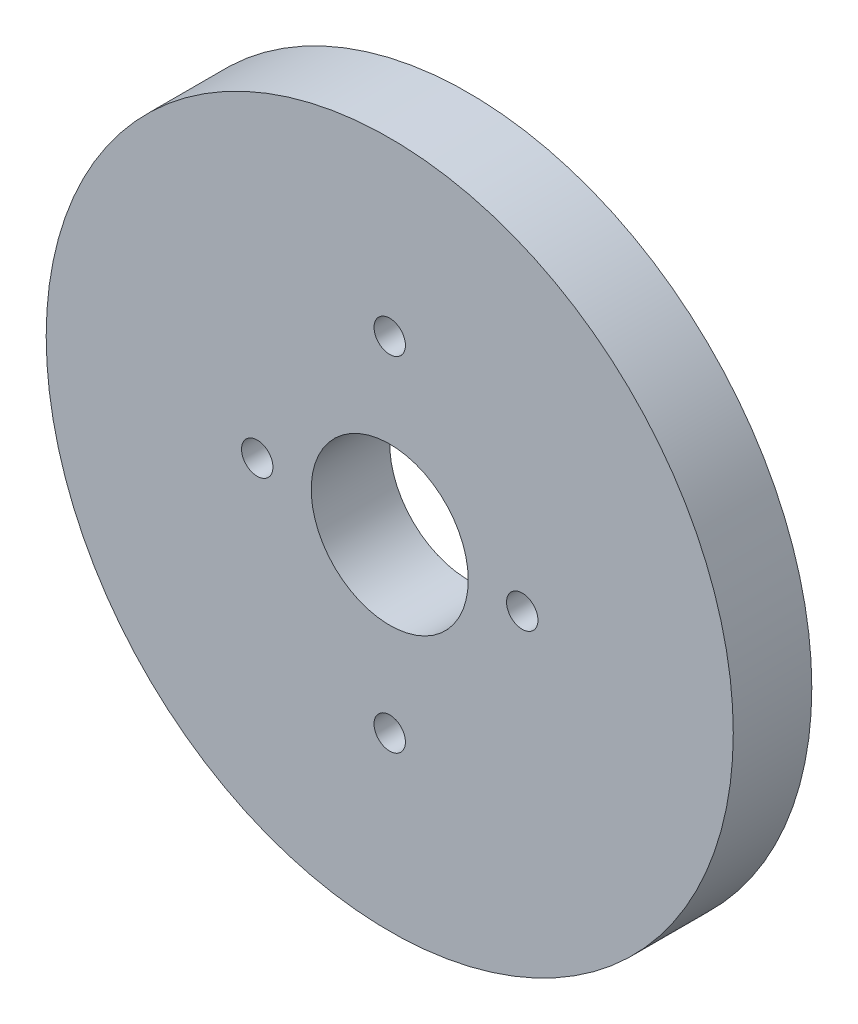
from build123d import *

# Parameters (mm, degrees)
SKETCH1_R           = 17.5
SKETCH1_R_2         = 4
SKETCH1_R_3         = 0.8
BOSS_EXTRUDE1_DEPTH = 4


with BuildPart() as part:
    # Sketch1 → Boss-Extrude1 (new body)
    with BuildSketch(Plane.XY):
        Circle(SKETCH1_R)
        Circle(SKETCH1_R_2, mode=Mode.SUBTRACT)
        with Locations((6.75, 0)):
            Circle(SKETCH1_R_3, mode=Mode.SUBTRACT)
        with Locations((0, 8.75)):
            Circle(SKETCH1_R_3, mode=Mode.SUBTRACT)
        with Locations(Location((0, -8.75, 0), (0, 0, 180))):
            Circle(SKETCH1_R_3, mode=Mode.SUBTRACT)
        with Locations(Location((-6.75, 0, 0), (0, 0, 180))):
            Circle(SKETCH1_R_3, mode=Mode.SUBTRACT)
    extrude(amount=BOSS_EXTRUDE1_DEPTH)


solid = part.part
